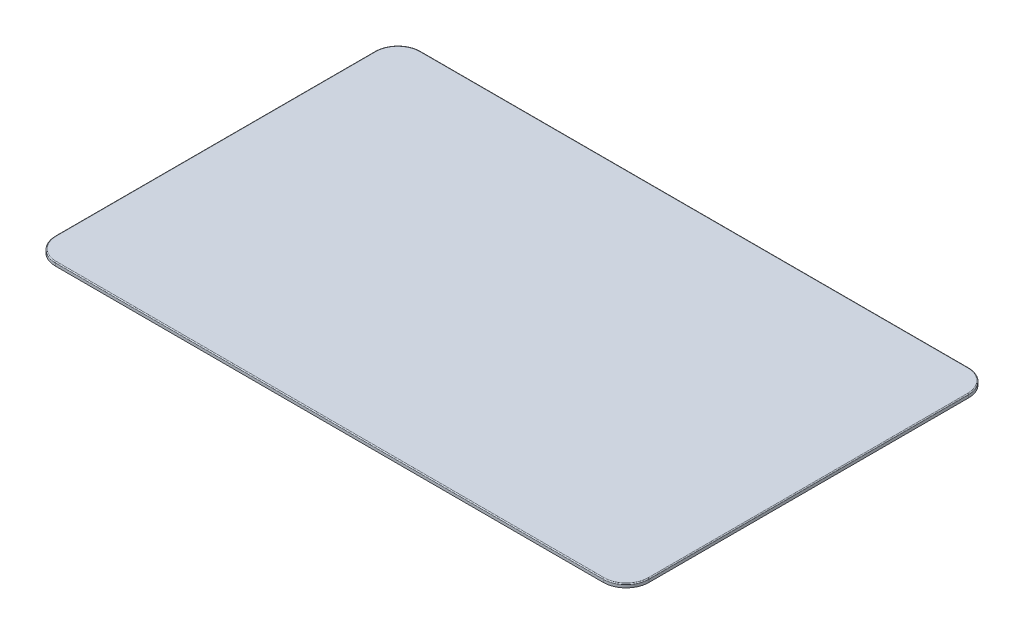
from build123d import *

# Parameters (mm, degrees)
EXTRUDE_1_DEPTH     = 8
FILLET_1_R          = 2
CUT_EXTRUDE_1_DEPTH = 6


with BuildPart() as part:
    # Эскиз1 → Бобышка-Вытянуть1 (new body)
    with BuildSketch(Plane(origin=(0, 0, 0), x_dir=(1, 0, 0), z_dir=(0, 1, 0))):
        with BuildLine():
            Line((-600, -400), (600, -400))
            ThreePointArc((600, -400), (635.355339059, -385.355339059), (650, -350))
            Line((650, -350), (650, 350))
            ThreePointArc((650, 350), (635.355339059, 385.355339059), (600, 400))
            Line((600, 400), (-600, 400))
            ThreePointArc((-600, 400), (-635.355339059, 385.355339059), (-650, 350))
            Line((-650, 350), (-650, -350))
            ThreePointArc((-650, -350), (-635.355339059, -385.355339059), (-600, -400))
        make_face()
    extrude(amount=EXTRUDE_1_DEPTH)

    # Скругление1
    fillet_1_edges = [part.edges().sort_by_distance(p)[0] for p in [
        (635.355339059, 8, -385.355339059),
        (0, 8, -400),
        (-635.355339059, 8, -385.355339059),
        (-650, 8, 0),
        (-635.355339059, 8, 385.355339059),
        (0, 8, 400),
        (635.355339059, 8, 385.355339059),
        (650, 8, 0),
    ]]
    fillet(fillet_1_edges, radius=FILLET_1_R)

    # Эскиз2 → Вырез-Вытянуть1 (cut)
    with BuildSketch(Plane.XZ):
        with BuildLine():
            Line((-505.5, -118.713883744), (-423, -118.713883744))
            ThreePointArc((-423, -118.713883744), (-419.464466094, -117.24941765), (-418, -113.713883744))
            Line((-418, -113.713883744), (-418, -19.5))
            ThreePointArc((-418, -19.5), (-416.535533906, -15.964466094), (-413, -14.5))
            Line((-413, -14.5), (-297.5, -14.5))
            Line((-297.5, -14.5), (-297.5, -207.927682204))
            ThreePointArc((-297.5, -207.927682204), (-298.971774479, -211.470509418), (-302.520649868, -212.927639562))
            Line((-302.520649868, -212.927639562), (-307.759216244, -212.906004237))
            ThreePointArc((-307.759216244, -212.906004237), (-312.019645969, -211.120626595), (-310.269519857, -215.395657982))
            Line((-310.269519857, -215.395657982), (-310.538832295, -280.604342018))
            ThreePointArc((-310.538832295, -280.604342018), (-312.320570836, -284.868433457), (-308.049157229, -283.104320697))
            Line((-308.049157229, -283.104320697), (-262.240805077, -283.104320697))
            ThreePointArc((-262.240805077, -283.104320697), (-257.973038124, -284.87208765), (-259.740805077, -280.604320697))
            Line((-259.740805077, -280.604320697), (-259.740805077, -215.604320697))
            ThreePointArc((-259.740805077, -215.604320697), (-257.969391469, -211.340207936), (-262.240783756, -213.093995763))
            Line((-262.240783756, -213.093995763), (-267.520649867, -213.07218987))
            ThreePointArc((-267.520649867, -213.07218987), (-271.042827214, -211.600458033), (-272.5, -208.072232512))
            Line((-272.5, -208.072232512), (-272.5, -204.286116256))
            ThreePointArc((-272.5, -204.286116256), (-271.035533905, -200.75058235), (-267.5, -199.286116256))
            Line((-267.5, -199.286116256), (-232.5, -199.286116256))
            ThreePointArc((-232.5, -199.286116256), (-228.964466094, -200.75058235), (-227.5, -204.286116256))
            Line((-227.5, -204.286116256), (-227.5, -208.072232512))
            ThreePointArc((-227.5, -208.072232512), (-228.957172785, -211.600458033), (-232.479350132, -213.07218987))
            Line((-232.479350132, -213.07218987), (-237.759216244, -213.093995763))
            ThreePointArc((-237.759216244, -213.093995763), (-242.03060853, -211.340207936), (-240.259194923, -215.604320697))
            Line((-240.259194923, -215.604320697), (-240.259194923, -280.604320697))
            ThreePointArc((-240.259194923, -280.604320697), (-242.026961876, -284.87208765), (-237.759194923, -283.104320697))
            Line((-237.759194923, -283.104320697), (-191.950842771, -283.104320697))
            ThreePointArc((-191.950842771, -283.104320697), (-187.679429163, -284.868433457), (-189.461167705, -280.604342018))
            Line((-189.461167705, -280.604342018), (-189.730480143, -215.395657982))
            ThreePointArc((-189.730480143, -215.395657982), (-187.980354031, -211.120626595), (-192.240783756, -212.906004237))
            Line((-192.240783756, -212.906004237), (-197.479350132, -212.927639562))
            ThreePointArc((-197.479350132, -212.927639562), (-201.028225521, -211.470509418), (-202.5, -207.927682204))
            Line((-202.5, -207.927682204), (-202.5, -179.286116256))
            ThreePointArc((-202.5, -179.286116256), (-203.964466094, -175.75058235), (-207.5, -174.286116256))
            Line((-207.5, -174.286116256), (-265.5, -174.286116256))
            ThreePointArc((-265.5, -174.286116256), (-269.035533906, -172.821650162), (-270.5, -169.286116256))
            Line((-270.5, -169.286116256), (-270.5, 174.286116256))
            ThreePointArc((-270.5, 174.286116256), (-269.035533906, 177.821650162), (-265.5, 179.286116256))
            Line((-265.5, 179.286116256), (-207.5, 179.286116256))
            ThreePointArc((-207.5, 179.286116256), (-203.964466094, 180.75058235), (-202.5, 184.286116256))
            Line((-202.5, 184.286116256), (-202.5, 207.927682204))
            ThreePointArc((-202.5, 207.927682204), (-201.028225521, 211.470509418), (-197.479350132, 212.927639562))
            Line((-197.479350132, 212.927639562), (-192.240783756, 212.906004237))
            ThreePointArc((-192.240783756, 212.906004237), (-187.980354031, 211.120626595), (-189.730480143, 215.395657982))
            Line((-189.730480143, 215.395657982), (-189.461167705, 280.604342018))
            ThreePointArc((-189.461167705, 280.604342018), (-187.679429163, 284.868433457), (-191.950842771, 283.104320697))
            Line((-191.950842771, 283.104320697), (-237.759194923, 283.104320697))
            ThreePointArc((-237.759194923, 283.104320697), (-242.026961876, 284.87208765), (-240.259194923, 280.604320697))
            Line((-240.259194923, 280.604320697), (-240.259194923, 218.104320697))
            ThreePointArc((-240.259194923, 218.104320697), (-241.723661017, 214.568786791), (-245.259194923, 213.104320697))
            Line((-245.259194923, 213.104320697), (-254.740805077, 213.104320697))
            ThreePointArc((-254.740805077, 213.104320697), (-258.276338983, 214.568786791), (-259.740805077, 218.104320697))
            Line((-259.740805077, 218.104320697), (-259.740805077, 280.604320697))
            ThreePointArc((-259.740805077, 280.604320697), (-257.973038124, 284.87208765), (-262.240805077, 283.104320697))
            Line((-262.240805077, 283.104320697), (-308.049157229, 283.104320697))
            ThreePointArc((-308.049157229, 283.104320697), (-312.320570836, 284.868433457), (-310.538832295, 280.604342018))
            Line((-310.538832295, 280.604342018), (-310.269519857, 215.395657982))
            ThreePointArc((-310.269519857, 215.395657982), (-312.019645969, 211.120626595), (-307.759216244, 212.906004237))
            Line((-307.759216244, 212.906004237), (-302.520649868, 212.927639562))
            ThreePointArc((-302.520649868, 212.927639562), (-298.971774479, 211.470509418), (-297.5, 207.927682204))
            Line((-297.5, 207.927682204), (-297.5, 14.5))
            Line((-297.5, 14.5), (-413, 14.5))
            ThreePointArc((-413, 14.5), (-416.535533906, 15.964466094), (-418, 19.5))
            Line((-418, 19.5), (-418, 113.713883744))
            ThreePointArc((-418, 113.713883744), (-419.464466094, 117.24941765), (-423, 118.713883744))
            Line((-423, 118.713883744), (-505.5, 118.713883744))
            ThreePointArc((-505.5, 118.713883744), (-509.035533906, 117.24941765), (-510.5, 113.713883744))
            Line((-510.5, 113.713883744), (-510.5, 85.072317796))
            ThreePointArc((-510.5, 85.072317796), (-511.971774479, 81.529490582), (-515.520649868, 80.072360438))
            Line((-515.520649868, 80.072360438), (-520.759216244, 80.093995763))
            ThreePointArc((-520.759216244, 80.093995763), (-525.019645969, 81.879373405), (-523.269519857, 77.604342018))
            Line((-523.269519857, 77.604342018), (-523.538832295, 12.395657982))
            ThreePointArc((-523.538832295, 12.395657982), (-525.320570836, 8.131566542), (-521.049157229, 9.895679303))
            Line((-521.049157229, 9.895679303), (-475.240805077, 9.895679303))
            ThreePointArc((-475.240805077, 9.895679303), (-470.973038124, 8.12791235), (-472.740805077, 12.395679303))
            Line((-472.740805077, 12.395679303), (-472.740805077, 77.395679303))
            ThreePointArc((-472.740805077, 77.395679303), (-470.96939147, 81.659792064), (-475.240783756, 79.906004237))
            Line((-475.240783756, 79.906004237), (-480.520649868, 79.92781013))
            ThreePointArc((-480.520649868, 79.92781013), (-484.042827214, 81.399541967), (-485.5, 84.927767488))
            Line((-485.5, 84.927767488), (-485.5, 88.713883744))
            ThreePointArc((-485.5, 88.713883744), (-484.035533906, 92.24941765), (-480.5, 93.713883744))
            Line((-480.5, 93.713883744), (-448, 93.713883744))
            ThreePointArc((-448, 93.713883744), (-444.464466094, 92.24941765), (-443, 88.713883744))
            Line((-443, 88.713883744), (-443, -88.713883744))
            ThreePointArc((-443, -88.713883744), (-444.464466094, -92.24941765), (-448, -93.713883744))
            Line((-448, -93.713883744), (-480.5, -93.713883744))
            ThreePointArc((-480.5, -93.713883744), (-484.035533906, -92.24941765), (-485.5, -88.713883744))
            Line((-485.5, -88.713883744), (-485.5, -84.927767488))
            ThreePointArc((-485.5, -84.927767488), (-484.042827214, -81.399541967), (-480.520649868, -79.92781013))
            Line((-480.520649868, -79.92781013), (-475.240783756, -79.906004237))
            ThreePointArc((-475.240783756, -79.906004237), (-470.96939147, -81.659792064), (-472.740805077, -77.395679303))
            Line((-472.740805077, -77.395679303), (-472.740805077, -12.395679303))
            ThreePointArc((-472.740805077, -12.395679303), (-470.973038124, -8.12791235), (-475.240805077, -9.895679303))
            Line((-475.240805077, -9.895679303), (-521.049157229, -9.895679303))
            ThreePointArc((-521.049157229, -9.895679303), (-525.320570836, -8.131566542), (-523.538832295, -12.395657982))
            Line((-523.538832295, -12.395657982), (-523.269519857, -77.604342018))
            ThreePointArc((-523.269519857, -77.604342018), (-525.019645969, -81.879373405), (-520.759216244, -80.093995763))
            Line((-520.759216244, -80.093995763), (-515.520649868, -80.072360438))
            ThreePointArc((-515.520649868, -80.072360438), (-511.971774479, -81.529490582), (-510.5, -85.072317796))
            Line((-510.5, -85.072317796), (-510.5, -113.713883744))
            ThreePointArc((-510.5, -113.713883744), (-509.035533906, -117.24941765), (-505.5, -118.713883744))
        make_face()
        with BuildLine():
            Line((302.520649868, -212.927639562), (307.759216244, -212.906004237))
            ThreePointArc((307.759216244, -212.906004237), (312.019645969, -211.120626595), (310.269519857, -215.395657982))
            Line((310.269519857, -215.395657982), (310.538832295, -280.604342018))
            ThreePointArc((310.538832295, -280.604342018), (312.320570836, -284.868433457), (308.049157229, -283.104320697))
            Line((308.049157229, -283.104320697), (262.240805077, -283.104320697))
            ThreePointArc((262.240805077, -283.104320697), (257.973038124, -284.87208765), (259.740805077, -280.604320697))
            Line((259.740805077, -280.604320697), (259.740805077, -218.093995763))
            ThreePointArc((259.740805077, -218.093995763), (258.276338983, -214.558461857), (254.740805077, -213.093995763))
            Line((254.740805077, -213.093995763), (245.259194923, -213.093995763))
            ThreePointArc((245.259194923, -213.093995763), (241.723661017, -214.558461857), (240.259194923, -218.093995763))
            Line((240.259194923, -218.093995763), (240.259194923, -280.604320697))
            ThreePointArc((240.259194923, -280.604320697), (242.026961876, -284.87208765), (237.759194923, -283.104320697))
            Line((237.759194923, -283.104320697), (191.950842771, -283.104320697))
            ThreePointArc((191.950842771, -283.104320697), (187.679429163, -284.868433457), (189.461167705, -280.604342018))
            Line((189.461167705, -280.604342018), (189.730480143, -215.395657982))
            ThreePointArc((189.730480143, -215.395657982), (187.980354031, -211.120626595), (192.240783756, -212.906004237))
            Line((192.240783756, -212.906004237), (197.479350132, -212.927639562))
            ThreePointArc((197.479350132, -212.927639562), (201.028225521, -211.470509418), (202.5, -207.927682204))
            Line((202.5, -207.927682204), (202.5, -184.286116256))
            ThreePointArc((202.5, -184.286116256), (203.964466094, -180.75058235), (207.5, -179.286116256))
            Line((207.5, -179.286116256), (265.5, -179.286116256))
            ThreePointArc((265.5, -179.286116256), (269.035533906, -177.821650162), (270.5, -174.286116256))
            Line((270.5, -174.286116256), (270.5, 169.286116256))
            ThreePointArc((270.5, 169.286116256), (269.035533906, 172.821650162), (265.5, 174.286116256))
            Line((265.5, 174.286116256), (207.5, 174.286116256))
            ThreePointArc((207.5, 174.286116256), (203.964466094, 175.75058235), (202.5, 179.286116256))
            Line((202.5, 179.286116256), (202.5, 207.927682204))
            ThreePointArc((202.5, 207.927682204), (201.028225521, 211.470509418), (197.479350132, 212.927639562))
            Line((197.479350132, 212.927639562), (192.240783756, 212.906004237))
            ThreePointArc((192.240783756, 212.906004237), (187.980354031, 211.120626595), (189.730480143, 215.395657982))
            Line((189.730480143, 215.395657982), (189.461167705, 280.604342018))
            ThreePointArc((189.461167705, 280.604342018), (187.679429163, 284.868433457), (191.950842771, 283.104320697))
            Line((191.950842771, 283.104320697), (237.759194923, 283.104320697))
            ThreePointArc((237.759194923, 283.104320697), (242.026961876, 284.87208765), (240.259194923, 280.604320697))
            Line((240.259194923, 280.604320697), (240.259194923, 215.604320697))
            ThreePointArc((240.259194923, 215.604320697), (242.03060853, 211.340207936), (237.759216244, 213.093995763))
            Line((237.759216244, 213.093995763), (232.479350132, 213.07218987))
            ThreePointArc((232.479350132, 213.07218987), (228.957172786, 211.600458033), (227.5, 208.072232512))
            Line((227.5, 208.072232512), (227.5, 204.286116256))
            ThreePointArc((227.5, 204.286116256), (228.964466094, 200.75058235), (232.5, 199.286116256))
            Line((232.5, 199.286116256), (267.5, 199.286116256))
            ThreePointArc((267.5, 199.286116256), (271.035533906, 200.75058235), (272.5, 204.286116256))
            Line((272.5, 204.286116256), (272.5, 208.072232512))
            ThreePointArc((272.5, 208.072232512), (271.042827214, 211.600458033), (267.520649868, 213.07218987))
            Line((267.520649868, 213.07218987), (262.240783756, 213.093995763))
            ThreePointArc((262.240783756, 213.093995763), (257.96939147, 211.340207936), (259.740805077, 215.604320697))
            Line((259.740805077, 215.604320697), (259.740805077, 280.604320697))
            ThreePointArc((259.740805077, 280.604320697), (257.973038124, 284.87208765), (262.240805077, 283.104320697))
            Line((262.240805077, 283.104320697), (308.049157229, 283.104320697))
            ThreePointArc((308.049157229, 283.104320697), (312.320570836, 284.868433457), (310.538832295, 280.604342018))
            Line((310.538832295, 280.604342018), (310.269519857, 215.395657982))
            ThreePointArc((310.269519857, 215.395657982), (312.019645969, 211.120626595), (307.759216244, 212.906004237))
            Line((307.759216244, 212.906004237), (302.520649868, 212.927639562))
            ThreePointArc((302.520649868, 212.927639562), (298.971774479, 211.470509418), (297.5, 207.927682204))
            Line((297.5, 207.927682204), (297.5, 19.5))
            ThreePointArc((297.5, 19.5), (298.964466094, 15.964466094), (302.5, 14.5))
            Line((302.5, 14.5), (418, 14.5))
            Line((418, 14.5), (418, 113.713883744))
            ThreePointArc((418, 113.713883744), (419.464466094, 117.24941765), (423, 118.713883744))
            Line((423, 118.713883744), (505.5, 118.713883744))
            ThreePointArc((505.5, 118.713883744), (509.035533906, 117.24941765), (510.5, 113.713883744))
            Line((510.5, 113.713883744), (510.5, 85.072317796))
            ThreePointArc((510.5, 85.072317796), (511.971774479, 81.529490582), (515.520649868, 80.072360438))
            Line((515.520649868, 80.072360438), (520.759216244, 80.093995763))
            ThreePointArc((520.759216244, 80.093995763), (525.019645969, 81.879373405), (523.269519857, 77.604342018))
            Line((523.269519857, 77.604342018), (523.538832295, 12.395657982))
            ThreePointArc((523.538832295, 12.395657982), (525.320570836, 8.131566542), (521.049157229, 9.895679303))
            Line((521.049157229, 9.895679303), (475.240805077, 9.895679303))
            ThreePointArc((475.240805077, 9.895679303), (470.973038124, 8.12791235), (472.740805077, 12.395679303))
            Line((472.740805077, 12.395679303), (472.740805077, 77.395679303))
            ThreePointArc((472.740805077, 77.395679303), (470.96939147, 81.659792064), (475.240783756, 79.906004237))
            Line((475.240783756, 79.906004237), (480.520649868, 79.92781013))
            ThreePointArc((480.520649868, 79.92781013), (484.042827214, 81.399541967), (485.5, 84.927767488))
            Line((485.5, 84.927767488), (485.5, 88.713883744))
            ThreePointArc((485.5, 88.713883744), (484.035533906, 92.24941765), (480.5, 93.713883744))
            Line((480.5, 93.713883744), (448, 93.713883744))
            ThreePointArc((448, 93.713883744), (444.464466094, 92.24941765), (443, 88.713883744))
            Line((443, 88.713883744), (443, -88.713883744))
            ThreePointArc((443, -88.713883744), (444.464466094, -92.24941765), (448, -93.713883744))
            Line((448, -93.713883744), (480.5, -93.713883744))
            ThreePointArc((480.5, -93.713883744), (484.035533906, -92.24941765), (485.5, -88.713883744))
            Line((485.5, -88.713883744), (485.5, -84.927767488))
            ThreePointArc((485.5, -84.927767488), (484.042827214, -81.399541967), (480.520649868, -79.92781013))
            Line((480.520649868, -79.92781013), (475.240783756, -79.906004237))
            ThreePointArc((475.240783756, -79.906004237), (470.96939147, -81.659792064), (472.740805077, -77.395679303))
            Line((472.740805077, -77.395679303), (472.740805077, -12.395679303))
            ThreePointArc((472.740805077, -12.395679303), (470.973038124, -8.12791235), (475.240805077, -9.895679303))
            Line((475.240805077, -9.895679303), (521.049157229, -9.895679303))
            ThreePointArc((521.049157229, -9.895679303), (525.320570836, -8.131566542), (523.538832295, -12.395657982))
            Line((523.538832295, -12.395657982), (523.269519857, -77.604342018))
            ThreePointArc((523.269519857, -77.604342018), (525.019645969, -81.879373405), (520.759216244, -80.093995763))
            Line((520.759216244, -80.093995763), (515.520649868, -80.072360438))
            ThreePointArc((515.520649868, -80.072360438), (511.971774479, -81.529490582), (510.5, -85.072317796))
            Line((510.5, -85.072317796), (510.5, -113.713883744))
            ThreePointArc((510.5, -113.713883744), (509.035533906, -117.24941765), (505.5, -118.713883744))
            Line((505.5, -118.713883744), (423, -118.713883744))
            ThreePointArc((423, -118.713883744), (419.464466094, -117.24941765), (418, -113.713883744))
            Line((418, -113.713883744), (418, -14.5))
            Line((418, -14.5), (302.5, -14.5))
            ThreePointArc((302.5, -14.5), (298.964466094, -15.964466094), (297.5, -19.5))
            Line((297.5, -19.5), (297.5, -207.927682204))
            ThreePointArc((297.5, -207.927682204), (298.971774479, -211.470509418), (302.520649868, -212.927639562))
        make_face()
        with BuildLine():
            Line((-102.176678262, 35.071051695), (-96.938111886, 35.092687021))
            ThreePointArc((-96.938111886, 35.092687021), (-92.677682161, 36.878064662), (-94.427808273, 32.603033275))
            Line((-94.427808273, 32.603033275), (-94.158495835, -32.60565076))
            ThreePointArc((-94.158495835, -32.60565076), (-92.376757294, -36.8697422), (-96.648170901, -35.105629439))
            Line((-96.648170901, -35.105629439), (-142.456523053, -35.105629439))
            ThreePointArc((-142.456523053, -35.105629439), (-146.724290006, -36.873396392), (-144.956523053, -32.605629439))
            Line((-144.956523053, -32.605629439), (-144.956523053, 32.394370561))
            ThreePointArc((-144.956523053, 32.394370561), (-146.72793666, 36.658483321), (-142.456544374, 34.904695494))
            Line((-142.456544374, 34.904695494), (-137.176678262, 34.926501388))
            ThreePointArc((-137.176678262, 34.926501388), (-133.654500916, 36.398233224), (-132.19732813, 39.926458746))
            Line((-132.19732813, 39.926458746), (-132.19732813, 110.071051695))
            ThreePointArc((-132.19732813, 110.071051695), (-130.732862036, 113.606585601), (-127.19732813, 115.071051695))
            Line((-127.19732813, 115.071051695), (127.80267187, 115.071051695))
            ThreePointArc((127.80267187, 115.071051695), (131.338205776, 113.606585601), (132.80267187, 110.071051695))
            Line((132.80267187, 110.071051695), (132.80267187, 40.071009054))
            ThreePointArc((132.80267187, 40.071009054), (134.368683547, 36.519880013), (137.969454992, 35.071655227))
            Line((137.969454992, 35.071655227), (143.061888114, 35.092687021))
            ThreePointArc((143.061888114, 35.092687021), (147.322317839, 36.878064662), (145.572191727, 32.603033275))
            Line((145.572191727, 32.603033275), (145.841504165, -32.60565076))
            ThreePointArc((145.841504165, -32.60565076), (147.623242706, -36.8697422), (143.351829099, -35.105629439))
            Line((143.351829099, -35.105629439), (97.543476947, -35.105629439))
            ThreePointArc((97.543476947, -35.105629439), (93.275709994, -36.873396392), (95.043476947, -32.605629439))
            Line((95.043476947, -32.605629439), (95.043476947, 32.394370561))
            ThreePointArc((95.043476947, 32.394370561), (93.27206334, 36.658483321), (97.543455626, 34.904695494))
            Line((97.543455626, 34.904695494), (102.070928869, 34.923393999))
            ThreePointArc((102.070928869, 34.923393999), (105.697122422, 36.438588713), (107.19732813, 40.071009054))
            Line((107.19732813, 40.071009054), (107.19732813, 85.071051695))
            ThreePointArc((107.19732813, 85.071051695), (105.732862036, 88.606585601), (102.19732813, 90.071051695))
            Line((102.19732813, 90.071051695), (17.19732813, 90.071051695))
            ThreePointArc((17.19732813, 90.071051695), (12.188175481, 84.749503723), (17.80267187, 80.071051695))
            Line((17.80267187, 80.071051695), (67.80267187, 80.071051695))
            ThreePointArc((67.80267187, 80.071051695), (71.338205776, 78.606585601), (72.80267187, 75.071051695))
            Line((72.80267187, 75.071051695), (72.80267187, 50.071051695))
            Line((72.80267187, 50.071051695), (72.80267187, 40.071009054))
            ThreePointArc((72.80267187, 40.071009054), (74.274446348, 36.528181839), (77.823321738, 35.071051695))
            Line((77.823321738, 35.071051695), (83.061888114, 35.092687021))
            ThreePointArc((83.061888114, 35.092687021), (87.322317839, 36.878064662), (85.572191727, 32.603033275))
            Line((85.572191727, 32.603033275), (85.841504165, -32.60565076))
            ThreePointArc((85.841504165, -32.60565076), (87.623242706, -36.8697422), (83.351829099, -35.105629439))
            Line((83.351829099, -35.105629439), (37.543476947, -35.105629439))
            ThreePointArc((37.543476947, -35.105629439), (33.275709994, -36.873396392), (35.043476947, -32.605629439))
            Line((35.043476947, -32.605629439), (35.043476947, 32.394370561))
            ThreePointArc((35.043476947, 32.394370561), (33.27206334, 36.658483321), (37.543455626, 34.904695494))
            Line((37.543455626, 34.904695494), (42.823321738, 34.926501388))
            ThreePointArc((42.823321738, 34.926501388), (46.345499084, 36.398233224), (47.80267187, 39.926458746))
            Line((47.80267187, 39.926458746), (47.80267187, 50.071051695))
            ThreePointArc((47.80267187, 50.071051695), (46.338205776, 53.606585601), (42.80267187, 55.071051695))
            Line((42.80267187, 55.071051695), (17.80267187, 55.071051695))
            ThreePointArc((17.80267187, 55.071051695), (14.267137964, 53.606585601), (12.80267187, 50.071051695))
            Line((12.80267187, 50.071051695), (12.80267187, 40.071009054))
            ThreePointArc((12.80267187, 40.071009054), (14.274446348, 36.528181839), (17.823321738, 35.071051695))
            Line((17.823321738, 35.071051695), (23.061888114, 35.092687021))
            ThreePointArc((23.061888114, 35.092687021), (27.322317839, 36.878064662), (25.572191727, 32.603033275))
            Line((25.572191727, 32.603033275), (25.841504165, -32.60565076))
            ThreePointArc((25.841504165, -32.60565076), (27.623242706, -36.8697422), (23.351829099, -35.105629439))
            Line((23.351829099, -35.105629439), (-22.456523053, -35.105629439))
            ThreePointArc((-22.456523053, -35.105629439), (-26.724290006, -36.873396392), (-24.956523053, -32.605629439))
            Line((-24.956523053, -32.605629439), (-24.956523053, 32.394370561))
            ThreePointArc((-24.956523053, 32.394370561), (-26.72793666, 36.658483321), (-22.456544374, 34.904695494))
            Line((-22.456544374, 34.904695494), (-17.176678262, 34.926501388))
            ThreePointArc((-17.176678262, 34.926501388), (-13.654500916, 36.398233224), (-12.19732813, 39.926458746))
            Line((-12.19732813, 39.926458746), (-12.19732813, 50.071051695))
            ThreePointArc((-12.19732813, 50.071051695), (-13.661794224, 53.606585601), (-17.19732813, 55.071051695))
            Line((-17.19732813, 55.071051695), (-42.19732813, 55.071051695))
            ThreePointArc((-42.19732813, 55.071051695), (-45.732862036, 53.606585601), (-47.19732813, 50.071051695))
            Line((-47.19732813, 50.071051695), (-47.19732813, 40.071009054))
            ThreePointArc((-47.19732813, 40.071009054), (-45.725553652, 36.528181839), (-42.176678262, 35.071051695))
            Line((-42.176678262, 35.071051695), (-36.938111886, 35.092687021))
            ThreePointArc((-36.938111886, 35.092687021), (-32.677682161, 36.878064662), (-34.427808273, 32.603033275))
            Line((-34.427808273, 32.603033275), (-34.158495835, -32.60565076))
            ThreePointArc((-34.158495835, -32.60565076), (-32.376757294, -36.8697422), (-36.648170901, -35.105629439))
            Line((-36.648170901, -35.105629439), (-82.456523053, -35.105629439))
            ThreePointArc((-82.456523053, -35.105629439), (-86.724290006, -36.873396392), (-84.956523053, -32.605629439))
            Line((-84.956523053, -32.605629439), (-84.956523053, 32.394370561))
            ThreePointArc((-84.956523053, 32.394370561), (-86.72793666, 36.658483321), (-82.456544374, 34.904695494))
            Line((-82.456544374, 34.904695494), (-77.176678262, 34.926501388))
            ThreePointArc((-77.176678262, 34.926501388), (-73.654500916, 36.398233224), (-72.19732813, 39.926458746))
            Line((-72.19732813, 39.926458746), (-72.19732813, 50.071051695))
            Line((-72.19732813, 50.071051695), (-72.19732813, 75.071051695))
            ThreePointArc((-72.19732813, 75.071051695), (-70.732862036, 78.606585601), (-67.19732813, 80.071051695))
            Line((-67.19732813, 80.071051695), (-17.19732813, 80.071051695))
            ThreePointArc((-17.19732813, 80.071051695), (-12.19732813, 85.071051695), (-17.19732813, 90.071051695))
            Line((-17.19732813, 90.071051695), (-102.19732813, 90.071051695))
            ThreePointArc((-102.19732813, 90.071051695), (-105.732862036, 88.606585601), (-107.19732813, 85.071051695))
            Line((-107.19732813, 85.071051695), (-107.19732813, 40.071009054))
            ThreePointArc((-107.19732813, 40.071009054), (-105.725553652, 36.528181839), (-102.176678262, 35.071051695))
        make_face()
    extrude(amount=-CUT_EXTRUDE_1_DEPTH, mode=Mode.SUBTRACT)


solid = part.part
